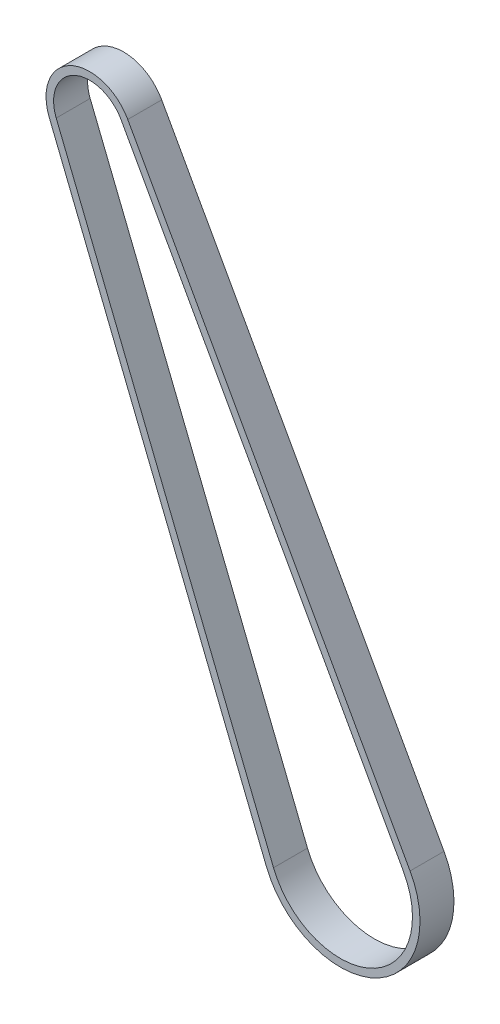
from build123d import *

# Parameters (mm, degrees)
EXTRUDE_THIN1_DEPTH = 4.5


with BuildPart() as part:
    # Sketch2 → Extrude-Thin1 (new, symmetric)
    with BuildSketch(Plane.XY):
        with BuildLine():
            Line((46.874718982, -147.570404716), (-10.716865759, -4.308193179))
            ThreePointArc((-10.716865759, -4.308193179), (-4.961581407, 10.430457809), (10.104259233, 5.59604195))
            Line((10.104259233, 5.59604195), (84.911704215, -129.476894135))
            ThreePointArc((84.911704215, -129.476894135), (75.516824707, -158.754838285), (46.874718982, -147.570404716))
        make_face()
        with BuildLine():
            Line((48.730389047, -146.824423074), (-8.861195694, -3.562211537))
            ThreePointArc((-8.861195694, -3.562211537), (-4.102462865, 8.624380477), (8.354664547, 4.627063915))
            Line((8.354664547, 4.627063915), (83.162109529, -130.44587217))
            ThreePointArc((83.162109529, -130.44587217), (74.657706165, -156.948760953), (48.730389047, -146.824423074))
        make_face(mode=Mode.SUBTRACT)
    extrude(amount=EXTRUDE_THIN1_DEPTH, both=True)


solid = part.part
